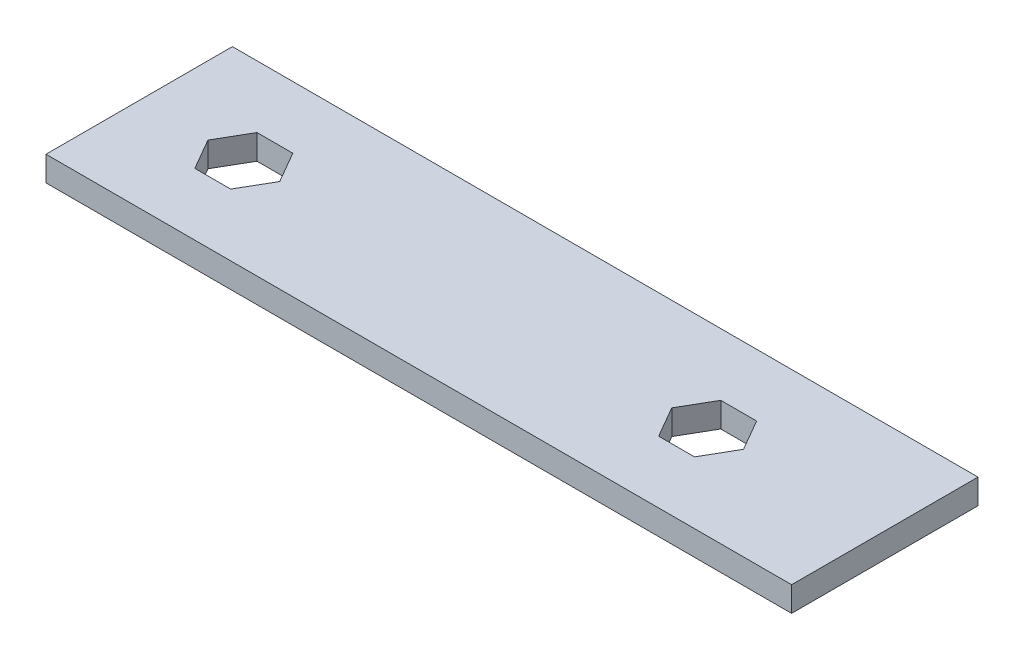
from build123d import *

# Parameters (mm, degrees)
SKETCH1_W           = 152.4
SKETCH1_H           = 38.1
BOSS_EXTRUDE1_DEPTH = 5.08
CUT_EXTRUDE1_DEPTH  = 158.172441605
CUT_EXTRUDE3_DEPTH  = 158.172441605


with BuildPart() as part:
    # Sketch1 → Boss-Extrude1 (new body)
    with BuildSketch(Plane(origin=(0, 0, 0), x_dir=(1, 0, 0), z_dir=(0, 1, 0))):
        with Locations((76.2, 19.05)):
            Rectangle(SKETCH1_W, SKETCH1_H)
    extrude(amount=BOSS_EXTRUDE1_DEPTH)

    # Sketch2 → Cut-Extrude1 (cut, through all)
    with BuildSketch(Plane(origin=(0, 5.08, 0), x_dir=(1, 0, 0), z_dir=(0, 1, 0))):
        Polygon((25.049816881, 12.7), (28.71599109, 19.05), (25.049816881, 25.4), (17.717468462, 25.4), (14.051294253, 19.05), (17.717468462, 12.7), align=None)
    extrude(amount=-CUT_EXTRUDE1_DEPTH, mode=Mode.SUBTRACT)

    # Sketch5 → Cut-Extrude3 (cut, through all)
    with BuildSketch(Plane(origin=(0, 5.08, 0), x_dir=(1, 0, 0), z_dir=(0, 1, 0))):
        Polygon((119.853560994, 25.4), (112.521212575, 25.4), (108.855038366, 19.05), (112.521212575, 12.7), (119.853560994, 12.7), (123.519735203, 19.05), align=None)
    extrude(amount=-CUT_EXTRUDE3_DEPTH, mode=Mode.SUBTRACT)


solid = part.part
